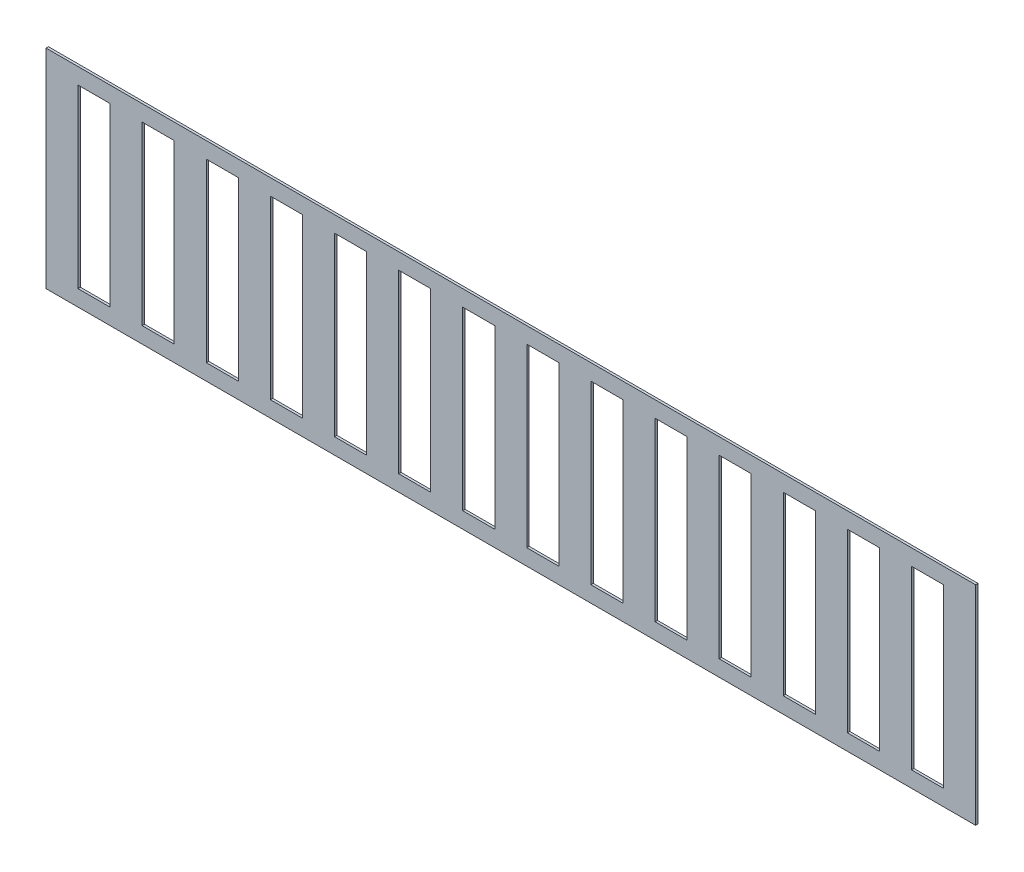
from build123d import *

# Parameters (mm, degrees)
TOPPING_PLINT_IZGARA_PANELI_1_START  = 18.5
SKETCH1_W                            = 580
SKETCH1_H                            = 130
TOPPING_PLINT_IZGARA_PANELI_1_DEPTH  = 1.5
TOPPING_PLINT_IZGARA_PANELI_2_START  = 17
SKETCH2_W                            = 20
SKETCH2_H                            = 110
TOPPING_PLINT_IZGARA_PANELI_2_DEPTH  = 4
TOPPING_PLINT_IZGARA_PANELI_3_START  = 17
SKETCH3_W                            = 20
SKETCH3_H                            = 110
TOPPING_PLINT_IZGARA_PANELI_3_DEPTH  = 4
TOPPING_PLINT_IZGARA_PANELI_4_START  = 17
SKETCH4_W                            = 20
SKETCH4_H                            = 110
TOPPING_PLINT_IZGARA_PANELI_4_DEPTH  = 4
TOPPING_PLINT_IZGARA_PANELI_5_START  = 17
SKETCH5_W                            = 20
SKETCH5_H                            = 110
TOPPING_PLINT_IZGARA_PANELI_5_DEPTH  = 4
TOPPING_PLINT_IZGARA_PANELI_6_START  = 17
SKETCH6_W                            = 20
SKETCH6_H                            = 110
TOPPING_PLINT_IZGARA_PANELI_6_DEPTH  = 4
TOPPING_PLINT_IZGARA_PANELI_7_START  = 17
SKETCH7_W                            = 20
SKETCH7_H                            = 110
TOPPING_PLINT_IZGARA_PANELI_7_DEPTH  = 4
TOPPING_PLINT_IZGARA_PANELI_8_START  = 17
SKETCH8_W                            = 20
SKETCH8_H                            = 110
TOPPING_PLINT_IZGARA_PANELI_8_DEPTH  = 4
TOPPING_PLINT_IZGARA_PANELI_9_START  = 17
SKETCH9_W                            = 20
SKETCH9_H                            = 110
TOPPING_PLINT_IZGARA_PANELI_9_DEPTH  = 4
TOPPING_PLINT_IZGARA_PANELI_10_START = 17
SKETCH10_W                           = 20
SKETCH10_H                           = 110
TOPPING_PLINT_IZGARA_PANELI_10_DEPTH = 4
TOPPING_PLINT_IZGARA_PANELI_11_START = 17
SKETCH11_W                           = 20
SKETCH11_H                           = 110
TOPPING_PLINT_IZGARA_PANELI_11_DEPTH = 4
TOPPING_PLINT_IZGARA_PANELI_12_START = 17
SKETCH12_W                           = 20
SKETCH12_H                           = 110
TOPPING_PLINT_IZGARA_PANELI_12_DEPTH = 4
TOPPING_PLINT_IZGARA_PANELI_13_START = 17
SKETCH13_W                           = 20
SKETCH13_H                           = 110
TOPPING_PLINT_IZGARA_PANELI_13_DEPTH = 4
TOPPING_PLINT_IZGARA_PANELI_14_START = 17
SKETCH14_W                           = 20
SKETCH14_H                           = 110
TOPPING_PLINT_IZGARA_PANELI_14_DEPTH = 4
TOPPING_PLINT_IZGARA_PANELI_15_START = 17
SKETCH15_W                           = 20
SKETCH15_H                           = 110
TOPPING_PLINT_IZGARA_PANELI_15_DEPTH = 4


with BuildPart() as part:
    # Sketch1 → TOPPING_plint_izgara_paneli_1 (new body)
    with BuildSketch(Plane.XY.offset(TOPPING_PLINT_IZGARA_PANELI_1_START)):
        with Locations((350, 105)):
            Rectangle(SKETCH1_W, SKETCH1_H)
    extrude(amount=TOPPING_PLINT_IZGARA_PANELI_1_DEPTH)

    # Sketch2 → TOPPING_plint_izgara_paneli_2 (cut)
    with BuildSketch(Plane.XY.offset(TOPPING_PLINT_IZGARA_PANELI_2_START)):
        with Locations((90, 105)):
            Rectangle(SKETCH2_W, SKETCH2_H)
    extrude(amount=TOPPING_PLINT_IZGARA_PANELI_2_DEPTH, mode=Mode.SUBTRACT)

    # Sketch3 → TOPPING_plint_izgara_paneli_3 (cut)
    with BuildSketch(Plane.XY.offset(TOPPING_PLINT_IZGARA_PANELI_3_START)):
        with Locations((130, 105)):
            Rectangle(SKETCH3_W, SKETCH3_H)
    extrude(amount=TOPPING_PLINT_IZGARA_PANELI_3_DEPTH, mode=Mode.SUBTRACT)

    # Sketch4 → TOPPING_plint_izgara_paneli_4 (cut)
    with BuildSketch(Plane.XY.offset(TOPPING_PLINT_IZGARA_PANELI_4_START)):
        with Locations((170, 105)):
            Rectangle(SKETCH4_W, SKETCH4_H)
    extrude(amount=TOPPING_PLINT_IZGARA_PANELI_4_DEPTH, mode=Mode.SUBTRACT)

    # Sketch5 → TOPPING_plint_izgara_paneli_5 (cut)
    with BuildSketch(Plane.XY.offset(TOPPING_PLINT_IZGARA_PANELI_5_START)):
        with Locations((210, 105)):
            Rectangle(SKETCH5_W, SKETCH5_H)
    extrude(amount=TOPPING_PLINT_IZGARA_PANELI_5_DEPTH, mode=Mode.SUBTRACT)

    # Sketch6 → TOPPING_plint_izgara_paneli_6 (cut)
    with BuildSketch(Plane.XY.offset(TOPPING_PLINT_IZGARA_PANELI_6_START)):
        with Locations((250, 105)):
            Rectangle(SKETCH6_W, SKETCH6_H)
    extrude(amount=TOPPING_PLINT_IZGARA_PANELI_6_DEPTH, mode=Mode.SUBTRACT)

    # Sketch7 → TOPPING_plint_izgara_paneli_7 (cut)
    with BuildSketch(Plane.XY.offset(TOPPING_PLINT_IZGARA_PANELI_7_START)):
        with Locations((290, 105)):
            Rectangle(SKETCH7_W, SKETCH7_H)
    extrude(amount=TOPPING_PLINT_IZGARA_PANELI_7_DEPTH, mode=Mode.SUBTRACT)

    # Sketch8 → TOPPING_plint_izgara_paneli_8 (cut)
    with BuildSketch(Plane.XY.offset(TOPPING_PLINT_IZGARA_PANELI_8_START)):
        with Locations((330, 105)):
            Rectangle(SKETCH8_W, SKETCH8_H)
    extrude(amount=TOPPING_PLINT_IZGARA_PANELI_8_DEPTH, mode=Mode.SUBTRACT)

    # Sketch9 → TOPPING_plint_izgara_paneli_9 (cut)
    with BuildSketch(Plane.XY.offset(TOPPING_PLINT_IZGARA_PANELI_9_START)):
        with Locations((370, 105)):
            Rectangle(SKETCH9_W, SKETCH9_H)
    extrude(amount=TOPPING_PLINT_IZGARA_PANELI_9_DEPTH, mode=Mode.SUBTRACT)

    # Sketch10 → TOPPING_plint_izgara_paneli_10 (cut)
    with BuildSketch(Plane.XY.offset(TOPPING_PLINT_IZGARA_PANELI_10_START)):
        with Locations((410, 105)):
            Rectangle(SKETCH10_W, SKETCH10_H)
    extrude(amount=TOPPING_PLINT_IZGARA_PANELI_10_DEPTH, mode=Mode.SUBTRACT)

    # Sketch11 → TOPPING_plint_izgara_paneli_11 (cut)
    with BuildSketch(Plane.XY.offset(TOPPING_PLINT_IZGARA_PANELI_11_START)):
        with Locations((450, 105)):
            Rectangle(SKETCH11_W, SKETCH11_H)
    extrude(amount=TOPPING_PLINT_IZGARA_PANELI_11_DEPTH, mode=Mode.SUBTRACT)

    # Sketch12 → TOPPING_plint_izgara_paneli_12 (cut)
    with BuildSketch(Plane.XY.offset(TOPPING_PLINT_IZGARA_PANELI_12_START)):
        with Locations((490, 105)):
            Rectangle(SKETCH12_W, SKETCH12_H)
    extrude(amount=TOPPING_PLINT_IZGARA_PANELI_12_DEPTH, mode=Mode.SUBTRACT)

    # Sketch13 → TOPPING_plint_izgara_paneli_13 (cut)
    with BuildSketch(Plane.XY.offset(TOPPING_PLINT_IZGARA_PANELI_13_START)):
        with Locations((530, 105)):
            Rectangle(SKETCH13_W, SKETCH13_H)
    extrude(amount=TOPPING_PLINT_IZGARA_PANELI_13_DEPTH, mode=Mode.SUBTRACT)

    # Sketch14 → TOPPING_plint_izgara_paneli_14 (cut)
    with BuildSketch(Plane.XY.offset(TOPPING_PLINT_IZGARA_PANELI_14_START)):
        with Locations((570, 105)):
            Rectangle(SKETCH14_W, SKETCH14_H)
    extrude(amount=TOPPING_PLINT_IZGARA_PANELI_14_DEPTH, mode=Mode.SUBTRACT)

    # Sketch15 → TOPPING_plint_izgara_paneli_15 (cut)
    with BuildSketch(Plane.XY.offset(TOPPING_PLINT_IZGARA_PANELI_15_START)):
        with Locations((610, 105)):
            Rectangle(SKETCH15_W, SKETCH15_H)
    extrude(amount=TOPPING_PLINT_IZGARA_PANELI_15_DEPTH, mode=Mode.SUBTRACT)


solid = part.part
